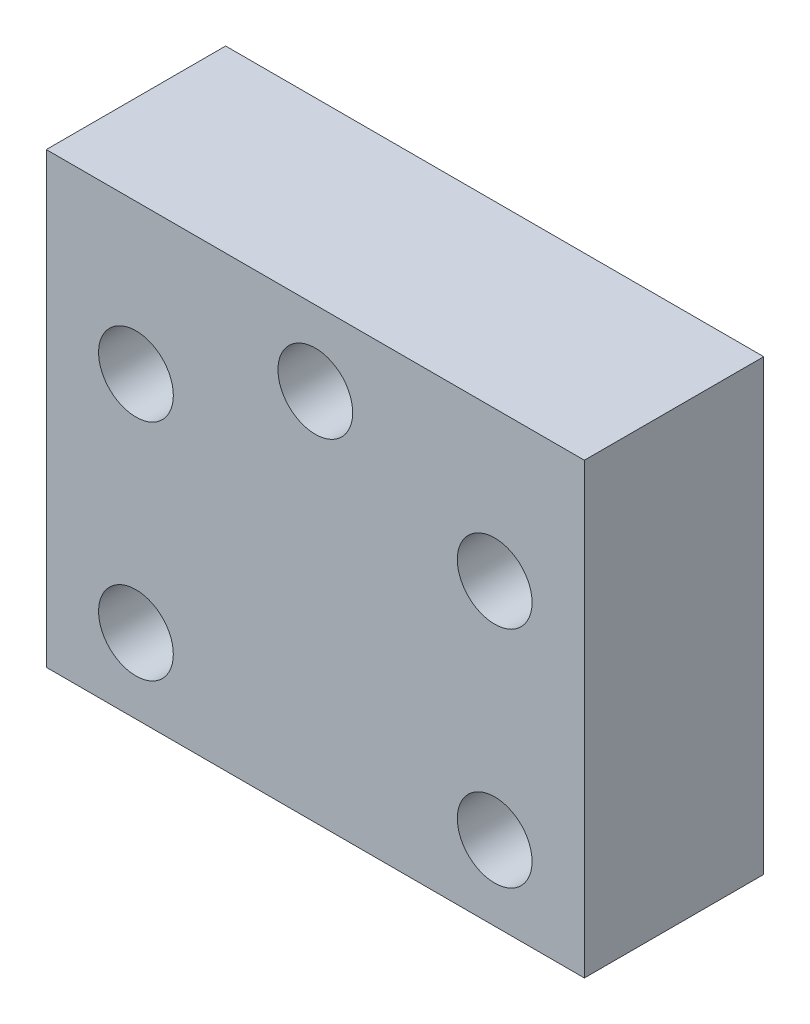
from build123d import *

# Parameters (mm, degrees)
SKETCH_1_W          = 36
SKETCH_1_H          = 30
EXTRUDE_1_DEPTH     = 12
SKETCH_2_R          = 2.5
CUT_EXTRUDE_2_DEPTH = 12
SKETCH_3_R          = 2.5
CUT_EXTRUDE_3_DEPTH = 12


with BuildPart() as part:
    # 草图1 → 凸台-拉伸1 (new body)
    with BuildSketch(Plane.XY):
        Rectangle(SKETCH_1_W, SKETCH_1_H)
    extrude(amount=EXTRUDE_1_DEPTH)

    # 草图2 → 切除-拉伸2 (cut)
    with BuildSketch(Plane.XY.offset(12)):
        with Locations((-12, 5)):
            Circle(SKETCH_2_R)
        with Locations((12, 5)):
            Circle(SKETCH_2_R)
        with Locations((12, -10)):
            Circle(SKETCH_2_R)
        with Locations((-12, -10)):
            Circle(SKETCH_2_R)
    extrude(amount=-CUT_EXTRUDE_2_DEPTH, mode=Mode.SUBTRACT)

    # 草图3 → 切除-拉伸3 (cut)
    with BuildSketch(Plane.XY.offset(12)):
        with Locations((0, 10)):
            Circle(SKETCH_3_R)
    extrude(amount=-CUT_EXTRUDE_3_DEPTH, mode=Mode.SUBTRACT)


solid = part.part
